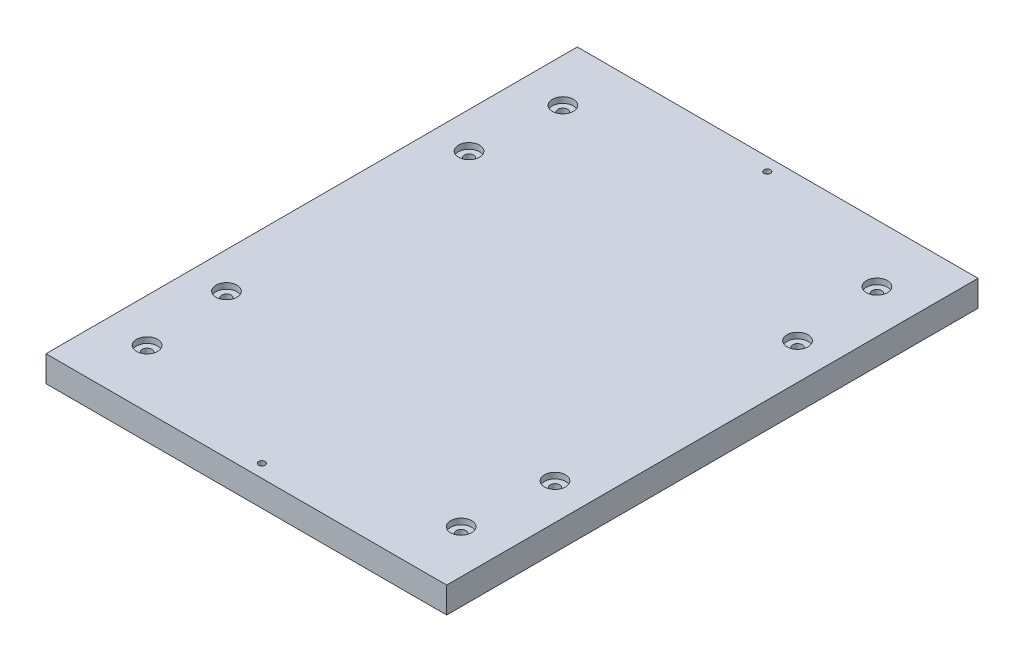
from build123d import *

# Parameters (mm, degrees)
SKETCH1_W                               = 277.55
SKETCH1_H                               = 368
BOSS_EXTRUDE1_DEPTH                     = 39
SKETCH2_OUTSIDE_W                       = 372.066
SKETCH2_OUTSIDE_H                       = 462.516
SKETCH2_OUTSIDE_W_2                     = 199.55
SKETCH2_OUTSIDE_H_2                     = 247
CUT_EXTRUDE1_DEPTH                      = 7
SKETCH3_OUTSIDE_W                       = 372.066
SKETCH3_OUTSIDE_H                       = 462.516
SKETCH3_OUTSIDE_W_2                     = 249.55
SKETCH3_OUTSIDE_H_2                     = 325
CUT_EXTRUDE2_DEPTH                      = 21
CBORE_FOR_M6_HEX_HEAD_BOLT1_D           = 6.6
CBORE_FOR_M6_HEX_HEAD_BOLT1_CBORE_D     = 14.547
CBORE_FOR_M6_HEX_HEAD_BOLT1_CBORE_DEPTH = 4
SKETCH8_W                               = 257.55
SKETCH8_H                               = 333
CUT_EXTRUDE3_DEPTH                      = 2.3
SKETCH9_R                               = 2.25
CUT_EXTRUDE4_DEPTH                      = 232.420614088


with BuildPart() as part:
    # Sketch1 → Boss-Extrude1 (new body)
    with BuildSketch(Plane(origin=(0, 0, 0), x_dir=(1, 0, 0), z_dir=(0, 1, 0))):
        Rectangle(SKETCH1_W, SKETCH1_H)
    extrude(amount=BOSS_EXTRUDE1_DEPTH)

    # Sketch2 outside → Cut-Extrude1 (cut)
    with BuildSketch(Plane(origin=(0, 0, 0), x_dir=(1, 0, 0), z_dir=(0, 1, 0))):
        Rectangle(SKETCH2_OUTSIDE_W, SKETCH2_OUTSIDE_H)
        Rectangle(SKETCH2_OUTSIDE_W_2, SKETCH2_OUTSIDE_H_2, mode=Mode.SUBTRACT)
    extrude(amount=CUT_EXTRUDE1_DEPTH, mode=Mode.SUBTRACT)

    # Sketch3 outside → Cut-Extrude2 (cut)
    with BuildSketch(Plane(origin=(0, 0, 0), x_dir=(1, 0, 0), z_dir=(0, 1, 0))):
        Rectangle(SKETCH3_OUTSIDE_W, SKETCH3_OUTSIDE_H)
        Rectangle(SKETCH3_OUTSIDE_W_2, SKETCH3_OUTSIDE_H_2, mode=Mode.SUBTRACT)
    extrude(amount=CUT_EXTRUDE2_DEPTH, mode=Mode.SUBTRACT)

    # CBORE for M6 Hex Head Bolt1 (through all)
    with Locations(Plane(origin=(0, 39, 0), x_dir=(1, 0, 0), z_dir=(0, 1, 0))):
        with Locations((-108.775, -144), (-113.775, -84), (-113.775, 84), (-108.775, 144), (108.775, 144), (113.775, 84), (113.775, -84), (108.775, -144)):
            CounterBoreHole(CBORE_FOR_M6_HEX_HEAD_BOLT1_D / 2, CBORE_FOR_M6_HEX_HEAD_BOLT1_CBORE_D / 2, CBORE_FOR_M6_HEX_HEAD_BOLT1_CBORE_DEPTH)

    # Sketch8 → Cut-Extrude3 (cut)
    with BuildSketch(Plane(origin=(0, 21, 0), x_dir=(1, 0, 0), z_dir=(0, 1, 0))):
        Rectangle(SKETCH8_W, SKETCH8_H)
        with BuildLine():
            Line((124.275, 162.5), (-124.275, 162.5))
            ThreePointArc((-124.275, 162.5), (-124.628553391, 162.353553391), (-124.775, 162))
            Line((-124.775, 162), (-124.775, -162))
            ThreePointArc((-124.775, -162), (-124.628553391, -162.353553391), (-124.275, -162.5))
            Line((-124.275, -162.5), (124.275, -162.5))
            ThreePointArc((124.275, -162.5), (124.628553391, -162.353553391), (124.775, -162))
            Line((124.775, -162), (124.775, 162))
            ThreePointArc((124.775, 162), (124.628553391, 162.353553391), (124.275, 162.5))
        make_face(mode=Mode.SUBTRACT)
    extrude(amount=CUT_EXTRUDE3_DEPTH, mode=Mode.SUBTRACT)

    # Sketch9 → Cut-Extrude4 (cut, through all)
    with BuildSketch(Plane(origin=(0, 21, 0), x_dir=(-1, 0, 0), z_dir=(0, -1, 0))):
        with Locations(Location((-1.775, -175, 0), (0, 0, 90))):
            Circle(SKETCH9_R)
        with Locations(Location((-1.775, 175, 0), (0, 0, 270))):
            Circle(SKETCH9_R)
    extrude(amount=-CUT_EXTRUDE4_DEPTH, mode=Mode.SUBTRACT)


solid = part.part
